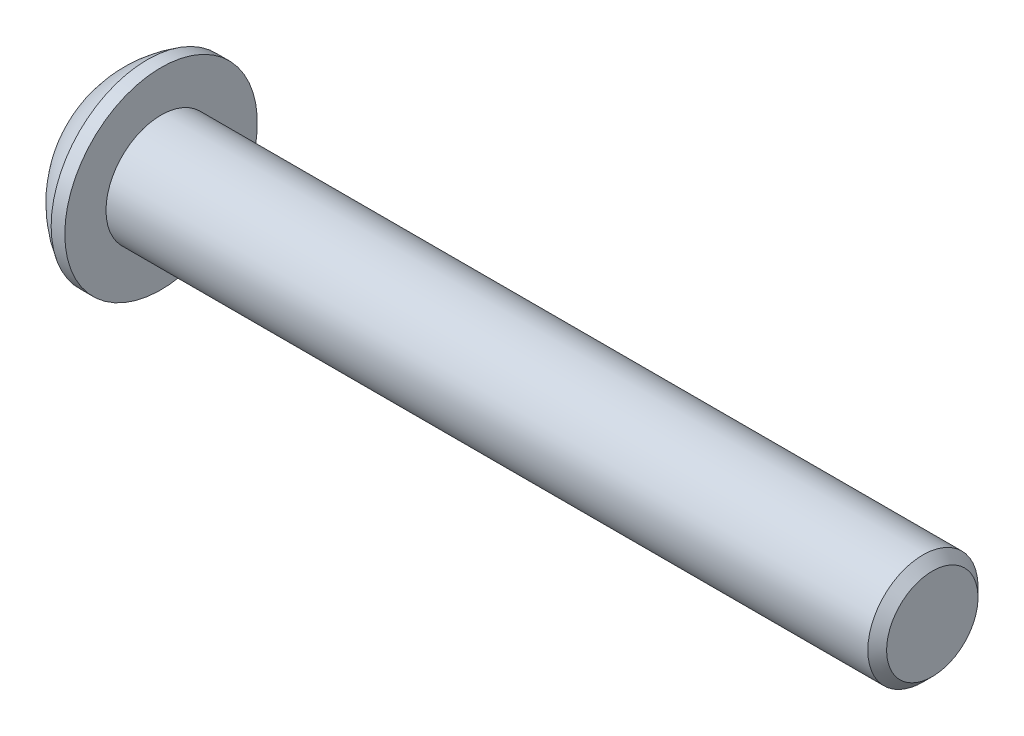
from build123d import *

# Parameters (mm, degrees)
HEX_2_DEPTH = 2.2098


with BuildPart() as part:
    # BodySke → BaseBody (revolve)
    with BuildSketch(Plane.XY, mode=Mode.PRIVATE) as basebody_sk:
        with BuildLine():
            Line((47.8028, 0), (47.8028, 2.63398))
            Line((47.8028, 2.63398), (47.26178, 3.175))
            Line((47.26178, 3.175), (3.3528, 3.175))
            Line((3.3528, 3.175), (3.3528, 5.5499))
            Line((3.3528, 5.5499), (2.5654, 5.5499))
            ThreePointArc((2.5654, 5.5499), (1.073764503, 4.355582759), (0, 2.77495))
            Line((0, 2.77495), (0, 0))
            Line((0, 0), (47.8028, 0))
        make_face()
    revolve(basebody_sk.sketch.rotate(Axis((0, 0, 0), (1, 0, 0)), 90), axis=Axis((0, 0, 0), (1, 0, 0)))

    # Sketch2 → PreBroach (revolve, cut)
    with BuildSketch(Plane.XY, mode=Mode.PRIVATE) as prebroach_sk:
        Polygon((0, 1.9812), (2.2098, 1.9812), (3.353646353, 0), (0, 0), align=None)
    revolve(prebroach_sk.sketch.rotate(Axis((0, 0, 0), (1, 0, 0)), 90), axis=Axis((0, 0, 0), (1, 0, 0)), mode=Mode.SUBTRACT)

    # Sketch3 → Hex 2 (cut)
    with BuildSketch(Plane(origin=(0, 0, 0), x_dir=(0, 0, -1), z_dir=(1, 0, 0))):
        Polygon((-1.9812, -1.143846353), (-1.9812, 1.143846353), (0, 2.287692707), (1.9812, 1.143846353), (1.9812, -1.143846353), (0, -2.287692707), align=None)
    extrude(amount=HEX_2_DEPTH, mode=Mode.SUBTRACT)


solid = part.part
